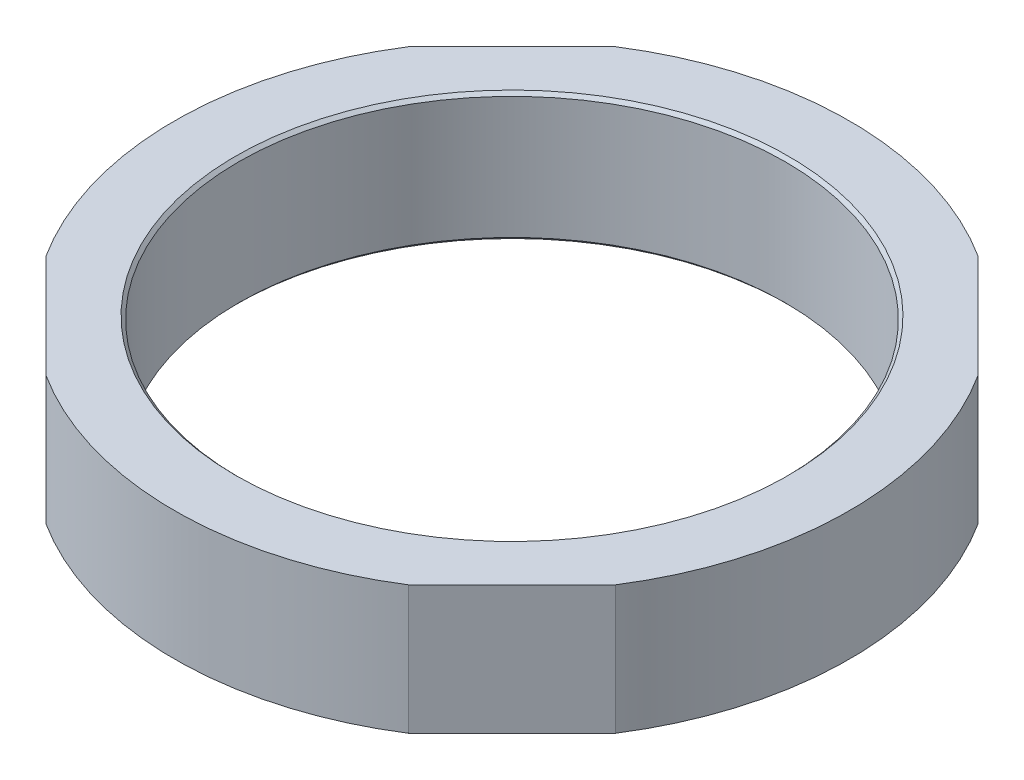
from build123d import *

# Parameters (mm, degrees)
BASES_R            = 21
BASES_R_2          = 17
BASE_DEPTH         = 4
FLATCUT_DEPTH      = 30.966648128
FCCIRPATTERN_COUNT = 4
BASECHAMFER_SIZE   = 0.2


with BuildPart() as part:
    # BaseS → Base (new, symmetric)
    with BuildSketch(Plane(origin=(0, 0, 0), x_dir=(1, 0, 0), z_dir=(0, 1, 0))):
        Circle(BASES_R)
        Circle(BASES_R_2, mode=Mode.SUBTRACT)
    extrude(amount=BASE_DEPTH, both=True)

    # FlatCutS → FlatCut (cut, symmetric)
    with BuildSketch(Plane(origin=(0, 0, 0), x_dir=(1, 0, 0), z_dir=(0, 1, 0))):
        with BuildLine():
            Line((11.274664333, 17.716713696), (17.716713696, 11.274664333))
            ThreePointArc((17.716713696, 11.274664333), (14.849242405, 14.849242405), (11.274664333, 17.716713696))
        make_face()
    flatcut = extrude(amount=FLATCUT_DEPTH, both=True, mode=Mode.SUBTRACT)

    # FCCirPattern: FlatCut ×4 about axis
    fccirpattern_axis = Axis((0, 1.1, 0), (0, -1, 0))
    for i in range(1, FCCIRPATTERN_COUNT):
        add(flatcut.rotate(fccirpattern_axis, i * 360 / FCCIRPATTERN_COUNT), mode=Mode.SUBTRACT)

    # BaseChamfer
    basechamfer_edges = [part.edges().sort_by_distance(p)[0] for p in [
        (-17, 4, 0),
        (-17, -4, 0),
    ]]
    chamfer(basechamfer_edges, length=BASECHAMFER_SIZE)


solid = part.part
